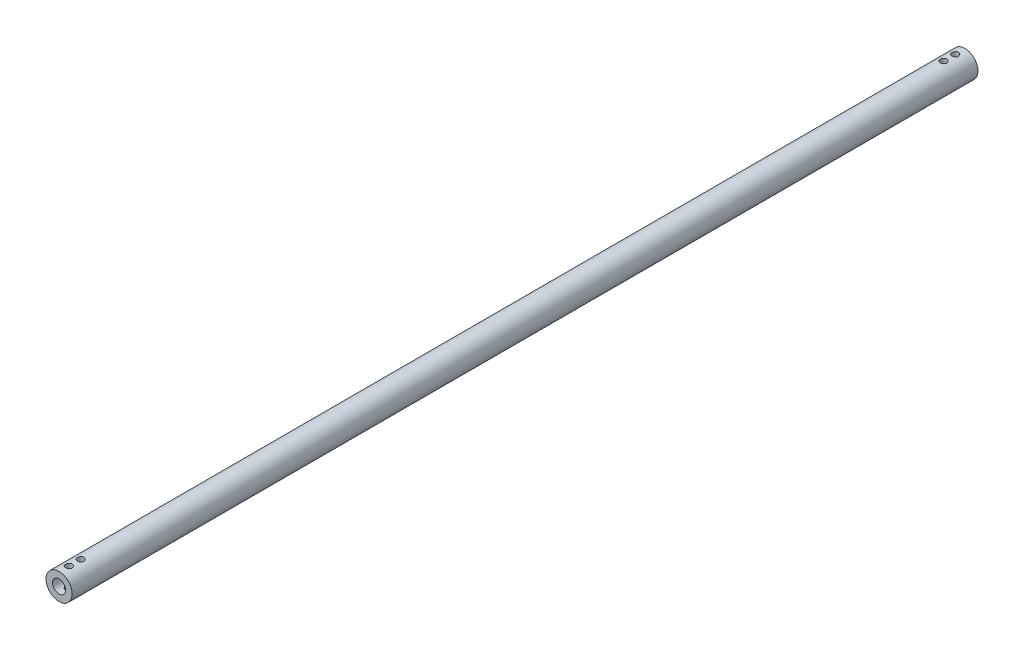
from build123d import *

# Parameters (mm, degrees)
SKETCH_1_R               = 10
SKETCH_1_R_2             = 5
EXTRUDE_1_DEPTH          = 694
CUT_EXTRUDE_1_DEPTH      = 695.144077264
CUT_EXTRUDE_1_DEPTH_BACK = 695.144077264
SKETCH_2_R               = 2.5


with BuildPart() as part:
    # 草图1 → 凸台-拉伸1 (new body)
    with BuildSketch(Plane.XY):
        Circle(SKETCH_1_R)
        Circle(SKETCH_1_R_2, mode=Mode.SUBTRACT)
    extrude(amount=EXTRUDE_1_DEPTH)

    # 草图2 → 切除-拉伸1 (cut, two sides: drawn at the far end of the back side and taken through both)
    with BuildSketch(Plane(origin=(0, 0, 0), x_dir=(1, 0, 0), z_dir=(0, 1, 0)).offset(-CUT_EXTRUDE_1_DEPTH_BACK)):
        with Locations(Location((0, -7.5, 0), (0, 0, 270))):
            Circle(SKETCH_2_R)
        with Locations(Location((0, -16.5, 0), (0, 0, 270))):
            Circle(SKETCH_2_R)
        with Locations(Location((0, -677.6, 0), (0, 0, 270))):
            Circle(SKETCH_2_R)
        with Locations(Location((0, -686.5, 0), (0, 0, 270))):
            Circle(SKETCH_2_R)
    extrude(amount=CUT_EXTRUDE_1_DEPTH + CUT_EXTRUDE_1_DEPTH_BACK, mode=Mode.SUBTRACT)


solid = part.part
